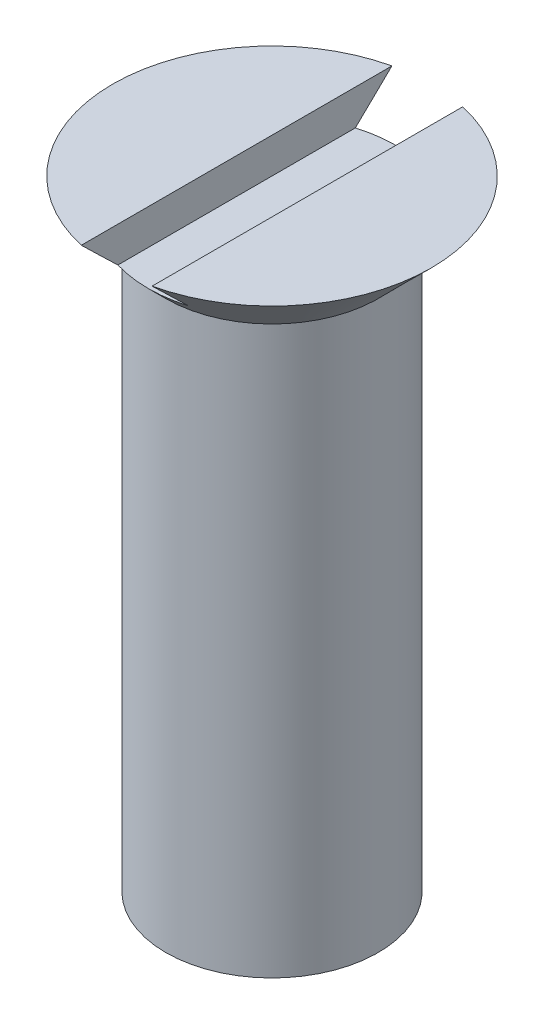
from build123d import *

# Parameters (mm, degrees)
SKETCH2_W      = 2
SKETCH2_H      = 9.797583912
EXTRUDE1_DEPTH = 1


with BuildPart() as part:
    # Sketch1 → Revolve1 (revolve)
    with BuildSketch(Plane.XY, mode=Mode.PRIVATE) as revolve1_sk:
        Polygon((0, 0), (-4.5, 0), (-3, -1.5), (-3, -17.5), (0, -19.232050808), (0, -17.5), align=None)
    revolve(revolve1_sk.sketch.rotate(Axis((0, 0, 0), (0, -1, 0)), 270), axis=Axis((0, 0, 0), (0, -1, 0)))

    # Sketch2 → Extrude1 (cut)
    with BuildSketch(Plane(origin=(0, 0, 0), x_dir=(1, 0, 0), z_dir=(0, 1, 0))):
        with Locations((0, -0.007322559)):
            Rectangle(SKETCH2_W, SKETCH2_H)
    extrude(amount=-EXTRUDE1_DEPTH, mode=Mode.SUBTRACT)


solid = part.part
